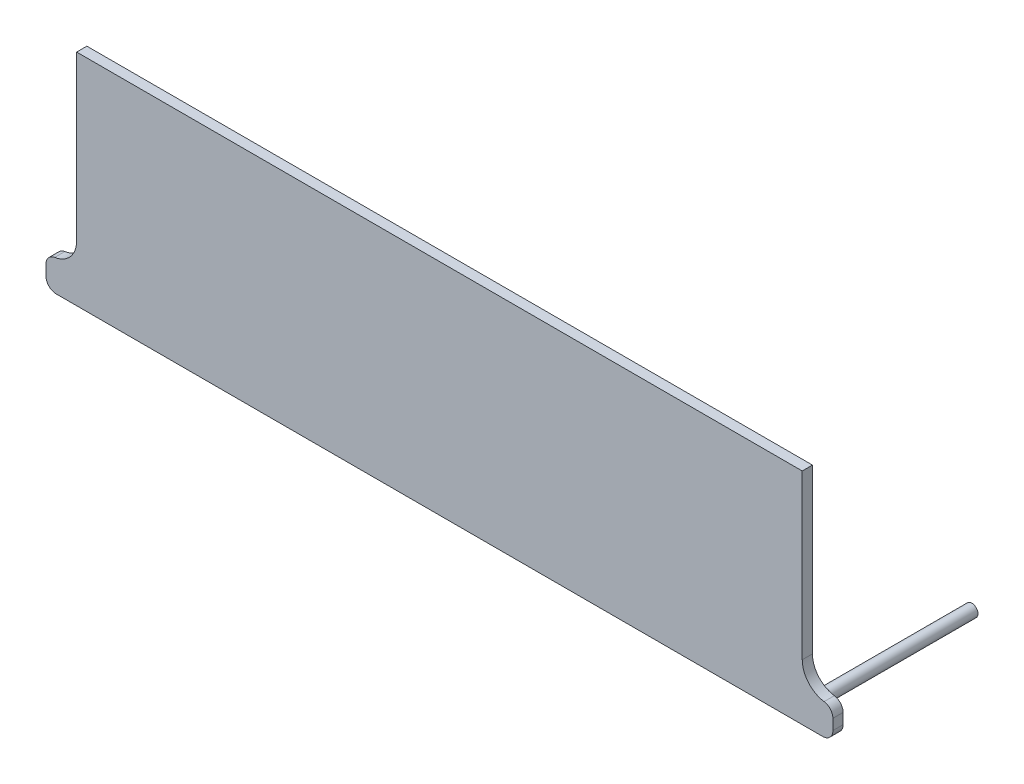
from build123d import *

# Parameters (mm, degrees)
BOSS_EXTRUDE1_DEPTH = 5
FILLET1_R           = 25
SKETCH2_R           = 6
BOSS_EXTRUDE2_DEPTH = 153
FILLET2_R           = 10
FILLET3_R           = 10


with BuildPart() as part:
    # Sketch1 → Boss-Extrude1 (new, symmetric)
    with BuildSketch(Plane.XY):
        Polygon((-355, -107.5), (-385, -107.5), (-385, -77.5), (-355, -77.5), (-355, 107.5), (355, 107.5), (355, -77.5), (385, -77.5), (385, -107.5), (355, -107.5), align=None)
    extrude(amount=BOSS_EXTRUDE1_DEPTH, both=True)

    # Fillet1
    fillet1_edges = [part.edges().sort_by_distance(p)[0] for p in [
        (-355, -77.5, 0),
        (355, -77.5, 0),
    ]]
    fillet(fillet1_edges, radius=FILLET1_R)

    # Sketch2 → Boss-Extrude2 (add)
    with BuildSketch(Plane(origin=(0, 0, -5), x_dir=(-1, 0, 0), z_dir=(0, 0, -1))):
        with Locations(Location((-358, -90.5, 0), (0, 0, 180))):
            Circle(SKETCH2_R)
        with Locations(Location((358, -90.5, 0), (0, 0, 180))):
            Circle(SKETCH2_R)
    extrude(amount=BOSS_EXTRUDE2_DEPTH)

    # Fillet2
    fillet2_edges = [part.edges().sort_by_distance(p)[0] for p in [
        (-385, -107.5, 0),
        (385, -107.5, 0),
        (352, -90.5, -5),
        (-364, -90.5, -5),
    ]]
    fillet(fillet2_edges, radius=FILLET2_R)

    # Fillet3
    fillet3_edges = [part.edges().sort_by_distance(p)[0] for p in [
        (-385, -77.5, 0),
        (385, -77.5, 0),
    ]]
    fillet(fillet3_edges, radius=FILLET3_R)


solid = part.part
